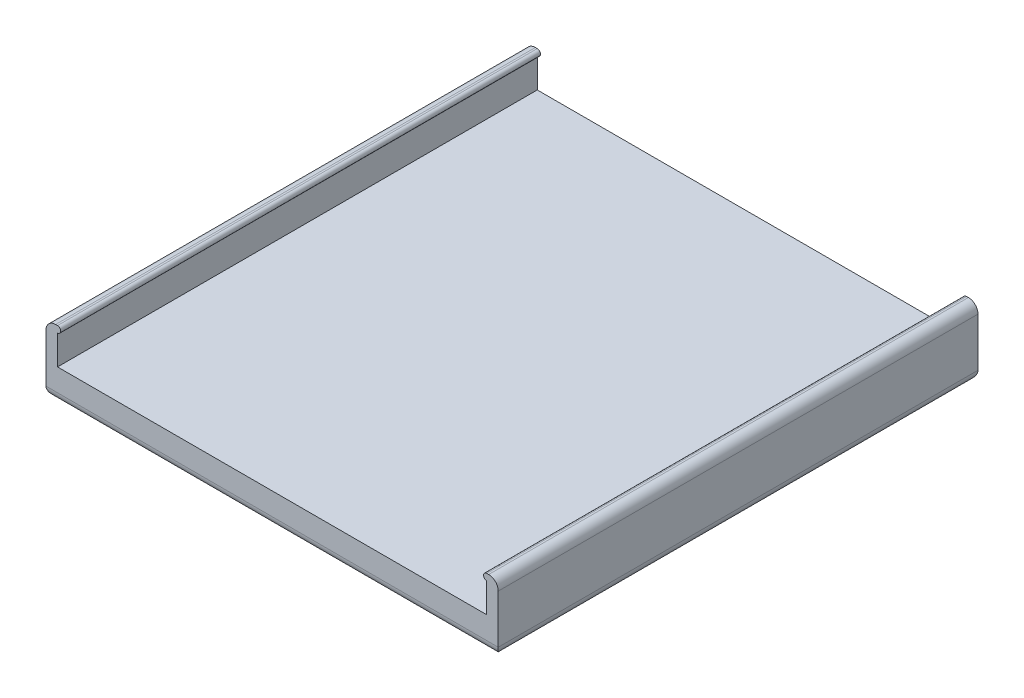
from build123d import *

# Parameters (mm, degrees)
SKETCH1_W           = 72.5
SKETCH1_H           = 75
BOSS_EXTRUDE1_DEPTH = 5
SKETCH2_R           = 27.1
SKETCH2_R_2         = 25.1
BOSS_EXTRUDE2_DEPTH = 5
SKETCH4_W           = 2.7
SKETCH4_H           = 75
BOSS_EXTRUDE3_DEPTH = 5.6
SKETCH5_R           = 0.5
BOSS_EXTRUDE4_DEPTH = 75
SKETCH6_W           = 0.9
SKETCH6_H           = 10.6
CUT_EXTRUDE1_DEPTH  = 84.972748556
FILLET1_R           = 2
FILLET2_R           = 1
FILLET3_R           = 1.5
FILLET4_R           = 1.5
SKETCH3_R           = 0.5


with BuildPart() as part:
    # Sketch1 → Boss-Extrude1 (new body)
    with BuildSketch(Plane(origin=(0, 0, 0), x_dir=(1, 0, 0), z_dir=(0, 1, 0))):
        Rectangle(SKETCH1_W, SKETCH1_H)
    extrude(amount=BOSS_EXTRUDE1_DEPTH)

    # Sketch2 → Boss-Extrude2 (add)
    with BuildSketch(Plane.XZ):
        with Locations(Location((0, 0, 0), (0, 0, 90))):
            Circle(SKETCH2_R)
        with Locations(Location((0, 0, 0), (0, 0, 270))):
            Circle(SKETCH2_R_2, mode=Mode.SUBTRACT)
    extrude(amount=BOSS_EXTRUDE2_DEPTH)

    # Sketch4 → Boss-Extrude3 (add)
    with BuildSketch(Plane(origin=(0, 5, 0), x_dir=(1, 0, 0), z_dir=(0, 1, 0))):
        with Locations((-34.9, 0)):
            Rectangle(SKETCH4_W, SKETCH4_H)
        with Locations((34.9, 0)):
            Rectangle(SKETCH4_W, SKETCH4_H)
    extrude(amount=BOSS_EXTRUDE3_DEPTH)

    # Sketch5 → Boss-Extrude4 (add)
    with BuildSketch(Plane.XY.offset(37.5)):
        with Locations((-33.55, 10.1)):
            Circle(SKETCH5_R)
        with Locations((33.55, 10.1)):
            Circle(SKETCH5_R)
    extrude(amount=-BOSS_EXTRUDE4_DEPTH)

    # Sketch6 → Cut-Extrude1 (cut, through all)
    with BuildSketch(Plane(origin=(0, 0, -37.5), x_dir=(-1, 0, 0), z_dir=(0, 0, -1))):
        with Locations((-35.8, 5.3)):
            Rectangle(SKETCH6_W, SKETCH6_H)
        with Locations((35.8, 5.3)):
            Rectangle(SKETCH6_W, SKETCH6_H)
    extrude(amount=-CUT_EXTRUDE1_DEPTH, mode=Mode.SUBTRACT)

    # Fillet1
    fillet1_edges = [part.edges().sort_by_distance(p)[0] for p in [
        (0, 0, -27.1),
    ]]
    fillet(fillet1_edges, radius=FILLET1_R)

    # Fillet2
    fillet2_edges = [part.edges().sort_by_distance(p)[0] for p in [
        (0, -5, 25.1),
    ]]
    fillet(fillet2_edges, radius=FILLET2_R)

    # Fillet3
    fillet3_edges = [part.edges().sort_by_distance(p)[0] for p in [
        (0, 0, -37.5),
        (0, 0, 37.5),
        (35.35, 0, 0),
        (-35.35, 0, 0),
    ]]
    fillet(fillet3_edges, radius=FILLET3_R)

    # Fillet4
    fillet4_edges = [part.edges().sort_by_distance(p)[0] for p in [
        (35.35, 10.6, 0),
        (-35.35, 10.6, 0),
    ]]
    fillet(fillet4_edges, radius=FILLET4_R)

    # Sketch3 → Revolve1 (revolve)
    with BuildSketch(Plane(origin=(0, 0, 0), x_dir=(0, 0, -1), z_dir=(1, 0, 0))):
        with Locations((-25.05, -1)):
            Circle(SKETCH3_R)
    revolve(axis=Axis((0, 0, 0), (0, -1, 0)))


solid = part.part
